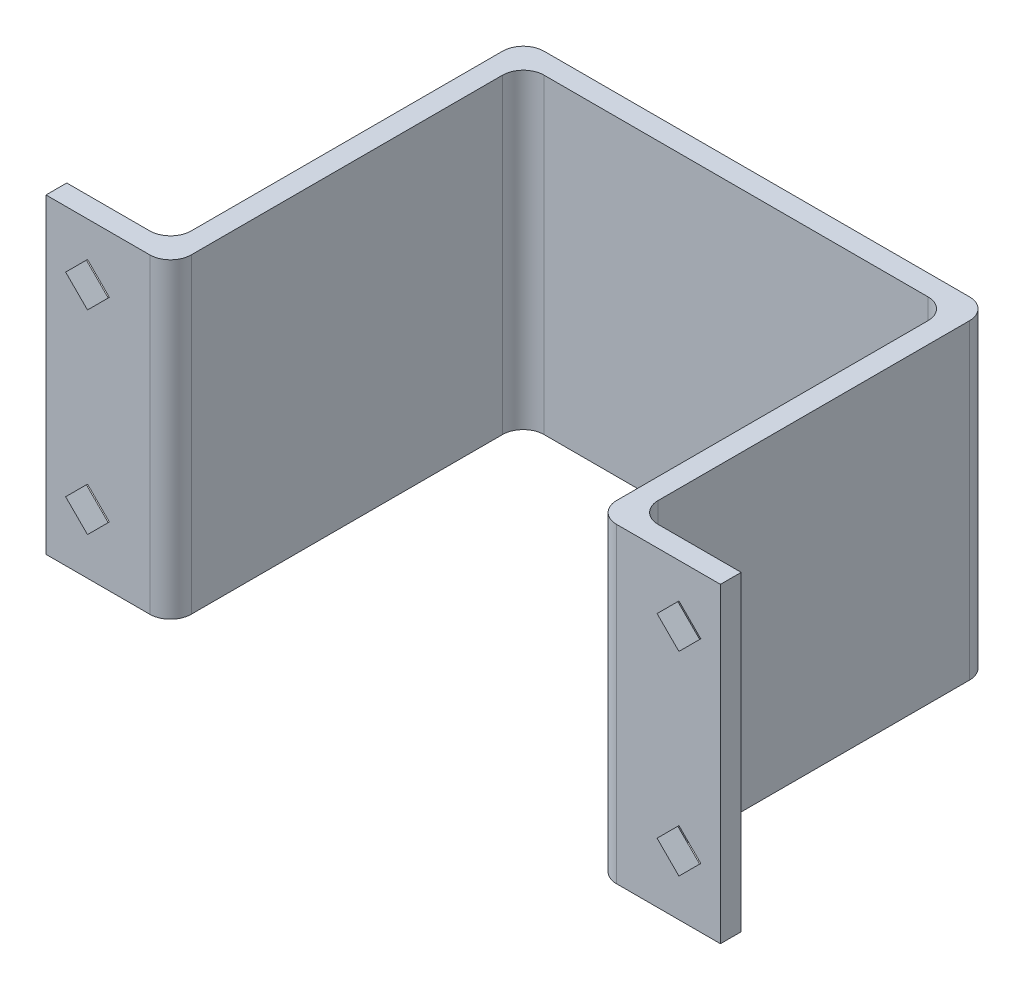
from build123d import *

# Parameters (mm, degrees)
SKETCH1_W           = 57.15
SKETCH1_H           = 38.1
BOSS_EXTRUDE1_DEPTH = 2.54
SKETCH2_W           = 2.54
SKETCH2_H           = 38.1
BOSS_EXTRUDE2_DEPTH = 43.18
SKETCH3_W           = 2.54
SKETCH3_H           = 38.1
BOSS_EXTRUDE3_DEPTH = 12.7
SKETCH4_W           = 2.54
SKETCH4_H           = 38.1
BOSS_EXTRUDE4_DEPTH = 12.7
FILLET1_R           = 2.54
CUT_EXTRUDE1_DEPTH  = 91.527039607


with BuildPart() as part:
    # Sketch1 → Boss-Extrude1 (new body)
    with BuildSketch(Plane.XY):
        with Locations((28.575, 19.05)):
            Rectangle(SKETCH1_W, SKETCH1_H)
    extrude(amount=BOSS_EXTRUDE1_DEPTH)

    # Sketch2 → Boss-Extrude2 (add)
    with BuildSketch(Plane.XY.offset(2.54)):
        with Locations((1.27, 19.05)):
            Rectangle(SKETCH2_W, SKETCH2_H)
        with Locations((55.88, 19.05)):
            Rectangle(SKETCH2_W, SKETCH2_H)
    extrude(amount=BOSS_EXTRUDE2_DEPTH)

    # Sketch3 → Boss-Extrude3 (add)
    with BuildSketch(Plane(origin=(57.15, 0, 0), x_dir=(0, 0, -1), z_dir=(1, 0, 0))):
        with Locations((-44.45, 19.05)):
            Rectangle(SKETCH3_W, SKETCH3_H)
    extrude(amount=BOSS_EXTRUDE3_DEPTH)

    # Sketch4 → Boss-Extrude4 (add)
    with BuildSketch(Plane.ZY):
        with Locations((44.45, 19.05)):
            Rectangle(SKETCH4_W, SKETCH4_H)
    extrude(amount=BOSS_EXTRUDE4_DEPTH)

    # Fillet1
    fillet1_edges = [part.edges().sort_by_distance(p)[0] for p in [
        (2.54, 19.05, 2.54),
        (2.54, 19.05, 45.72),
        (54.61, 19.05, 2.54),
        (54.61, 19.05, 45.72),
        (57.15, 19.05, 43.18),
        (57.15, 19.05, 0),
        (0, 19.05, 43.18),
        (0, 19.05, 0),
    ]]
    fillet(fillet1_edges, radius=FILLET1_R)

    # Sketch5 → Cut-Extrude1 (cut, through all)
    with BuildSketch(Plane(origin=(0, 0, 43.18), x_dir=(-1, 0, 0), z_dir=(0, 0, -1))):
        Polygon((-64.77, 33.800232648), (-67.446116324, 31.124116324), (-64.77, 28.448), (-62.093883676, 31.124116324), align=None)
        Polygon((-64.77, 9.987732648), (-67.446116324, 7.311616324), (-64.77, 4.6355), (-62.093883676, 7.311616324), align=None)
        Polygon((4.943883676, 7.311616324), (7.62, 9.987732648), (10.296116324, 7.311616324), (7.62, 4.6355), align=None)
        Polygon((4.943883676, 31.124116324), (7.62, 33.800232648), (10.296116324, 31.124116324), (7.62, 28.448), align=None)
    extrude(amount=-CUT_EXTRUDE1_DEPTH, mode=Mode.SUBTRACT)


solid = part.part
